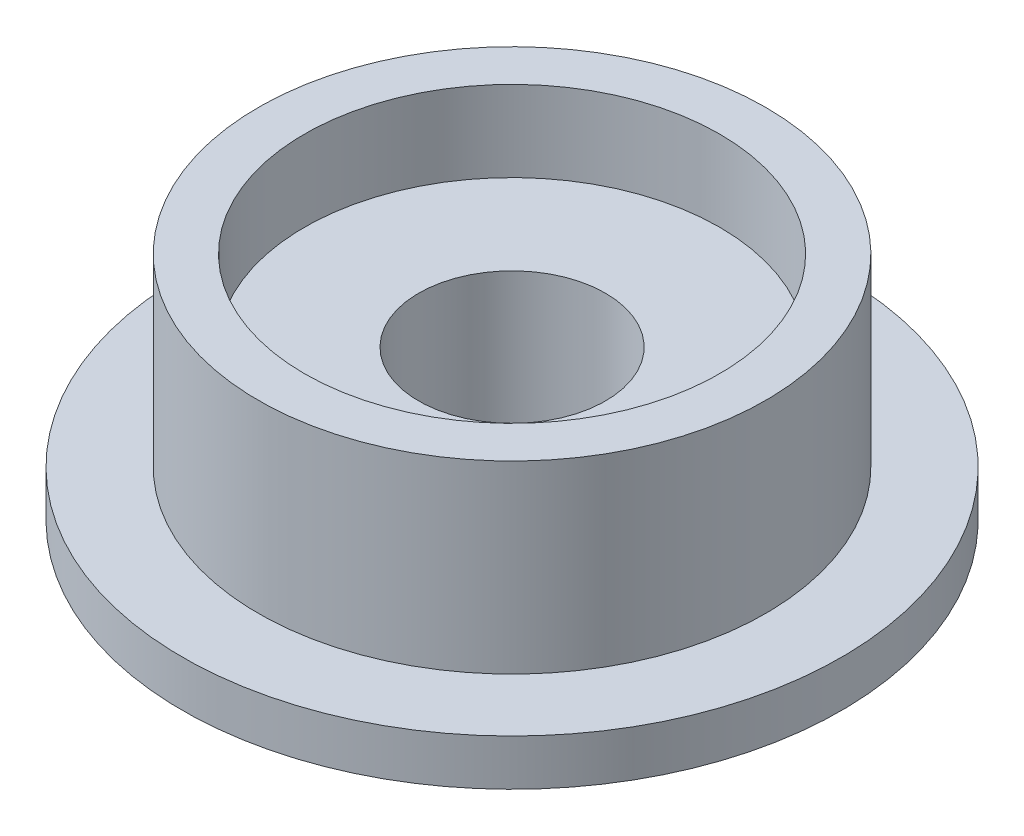
from build123d import *


with BuildPart() as part:
    # Sketch4 → Revolve1 (revolve)
    with BuildSketch(Plane.XY, mode=Mode.PRIVATE) as revolve1_sk:
        Polygon((4.05, 0), (4.05, 6.5), (9, 6.5), (9, 10), (11, 10), (11, 2), (14.2875, 2), (14.2875, 0), align=None)
    revolve(revolve1_sk.sketch.rotate(Axis((0, 0, 0), (0, 1, 0)), 90), axis=Axis((0, 0, 0), (0, 1, 0)))


solid = part.part
